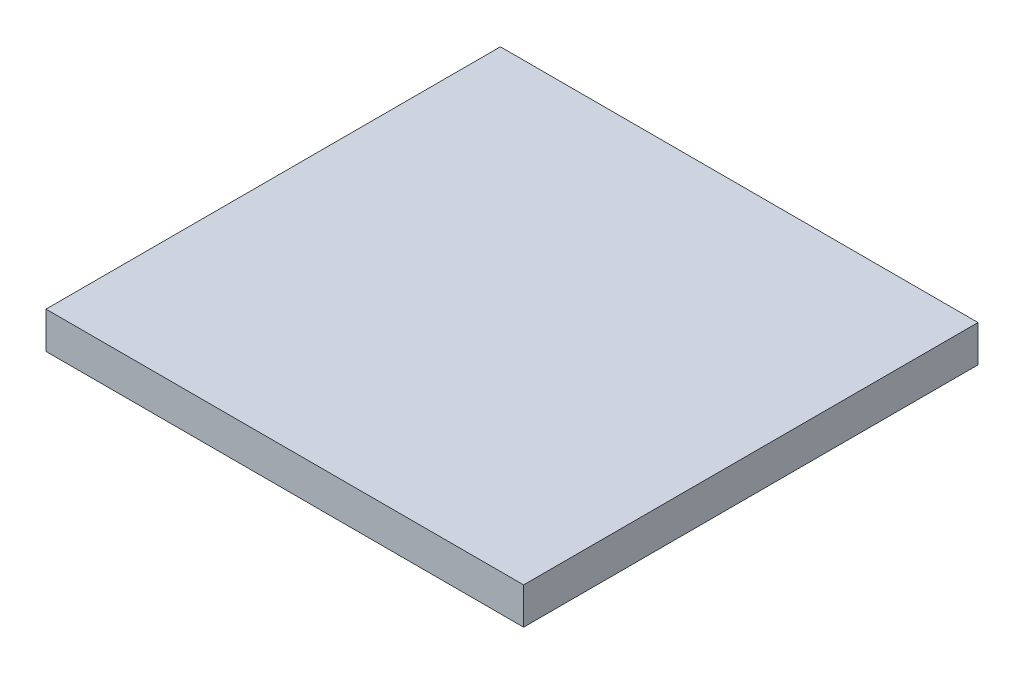
from build123d import *

# Parameters (mm, degrees)
SKETCH1_W           = 39.07
SKETCH1_H           = 37.17
BOSS_EXTRUDE1_DEPTH = 3


with BuildPart() as part:
    # Sketch1 → Boss-Extrude1 (new body)
    with BuildSketch(Plane(origin=(0, 0, 0), x_dir=(1, 0, 0), z_dir=(0, 1, 0))):
        Rectangle(SKETCH1_W, SKETCH1_H)
    extrude(amount=BOSS_EXTRUDE1_DEPTH)


solid = part.part
